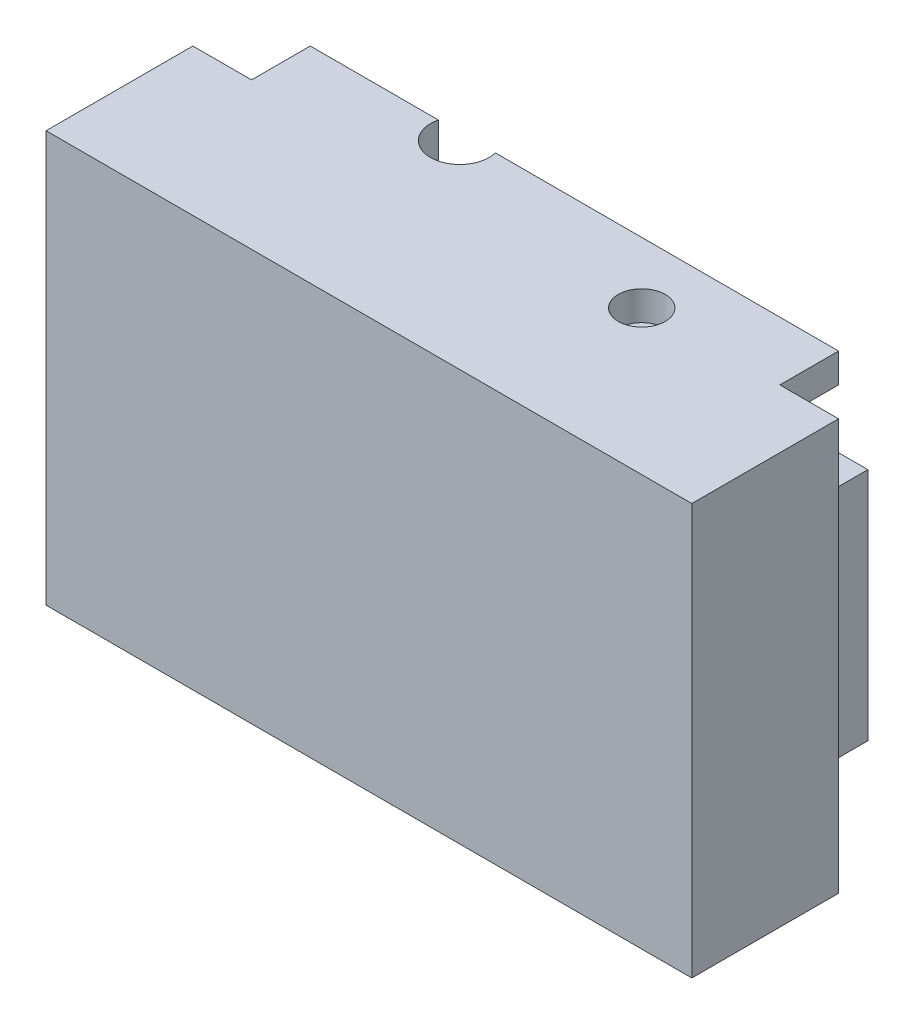
from build123d import *

# Parameters (mm, degrees)
SKETCH1_W           = 110
SKETCH1_H           = 70
BOSS_EXTRUDE1_DEPTH = 5
SKETCH2_W           = 90
SKETCH2_H           = 10
BOSS_EXTRUDE2_DEPTH = 20
SKETCH4_W           = 40
SKETCH4_H           = 10
CUT_EXTRUDE1_DEPTH  = 5
SKETCH5_W           = 5
SKETCH5_H           = 40
BOSS_EXTRUDE4_DEPTH = 10
BOSS_EXTRUDE5_DEPTH = 10
SKETCH7_R           = 5
CUT_EXTRUDE2_DEPTH  = 10
SKETCH8_R           = 4
CUT_EXTRUDE3_DEPTH  = 5


with BuildPart() as part:
    # Sketch1 → Boss-Extrude1 (new body)
    with BuildSketch(Plane.XY):
        with Locations((55, 35)):
            Rectangle(SKETCH1_W, SKETCH1_H)
    extrude(amount=BOSS_EXTRUDE1_DEPTH)

    # Sketch2 → Boss-Extrude2 (add)
    with BuildSketch(Plane(origin=(0, 0, 0), x_dir=(-1, 0, 0), z_dir=(0, 0, -1))):
        with Locations((-55, 65)):
            Rectangle(SKETCH2_W, SKETCH2_H)
        Polygon((-100, 70), (-110, 70), (-110, 0), (-100, 0), (-100, 10), (-100, 60), align=None)
        Polygon((0, 70), (-10, 70), (-10, 60), (-10, 10), (-10, 0), (0, 0), align=None)
        with Locations((-55, 5)):
            Rectangle(SKETCH2_W, SKETCH2_H)
    extrude(amount=BOSS_EXTRUDE2_DEPTH)

    # Sketch4 → Cut-Extrude1 (cut)
    with BuildSketch(Plane(origin=(0, 10, 0), x_dir=(1, 0, 0), z_dir=(0, 1, 0))):
        with Locations((55, 15)):
            Rectangle(SKETCH4_W, SKETCH4_H)
    extrude(amount=-CUT_EXTRUDE1_DEPTH, mode=Mode.SUBTRACT)

    # Sketch5 → Boss-Extrude4 (add)
    with BuildSketch(Plane(origin=(0, 0, -20), x_dir=(-1, 0, 0), z_dir=(0, 0, -1))):
        with Locations((-102.5, 35)):
            Rectangle(SKETCH5_W, SKETCH5_H)
        with Locations((-7.5, 35)):
            Rectangle(SKETCH5_W, SKETCH5_H)
    extrude(amount=BOSS_EXTRUDE4_DEPTH)

    # Sketch6 → Boss-Extrude5 (add)
    with BuildSketch(Plane(origin=(0, 0, -20), x_dir=(-1, 0, 0), z_dir=(0, 0, -1))):
        Polygon((-45, 60), (-30, 60), (-30, 65), (-10, 65), (-10, 70), (-100, 70), (-100, 65), (-85, 65), (-85, 60), (-65, 60), (-65, 65), (-45, 65), align=None)
    extrude(amount=BOSS_EXTRUDE5_DEPTH)

    # Sketch7 → Cut-Extrude2 (cut)
    with BuildSketch(Plane(origin=(0, 70, 0), x_dir=(1, 0, 0), z_dir=(0, 1, 0))):
        with Locations((36.69, 28.79)):
            Circle(SKETCH7_R)
    extrude(amount=-CUT_EXTRUDE2_DEPTH, mode=Mode.SUBTRACT)

    # Sketch8 → Cut-Extrude3 (cut)
    with BuildSketch(Plane(origin=(0, 70, 0), x_dir=(1, 0, 0), z_dir=(0, 1, 0))):
        with Locations(Location((76.88, 19.59, 0), (0, 0, 270))):
            Circle(SKETCH8_R)
    extrude(amount=-CUT_EXTRUDE3_DEPTH, mode=Mode.SUBTRACT)


solid = part.part
